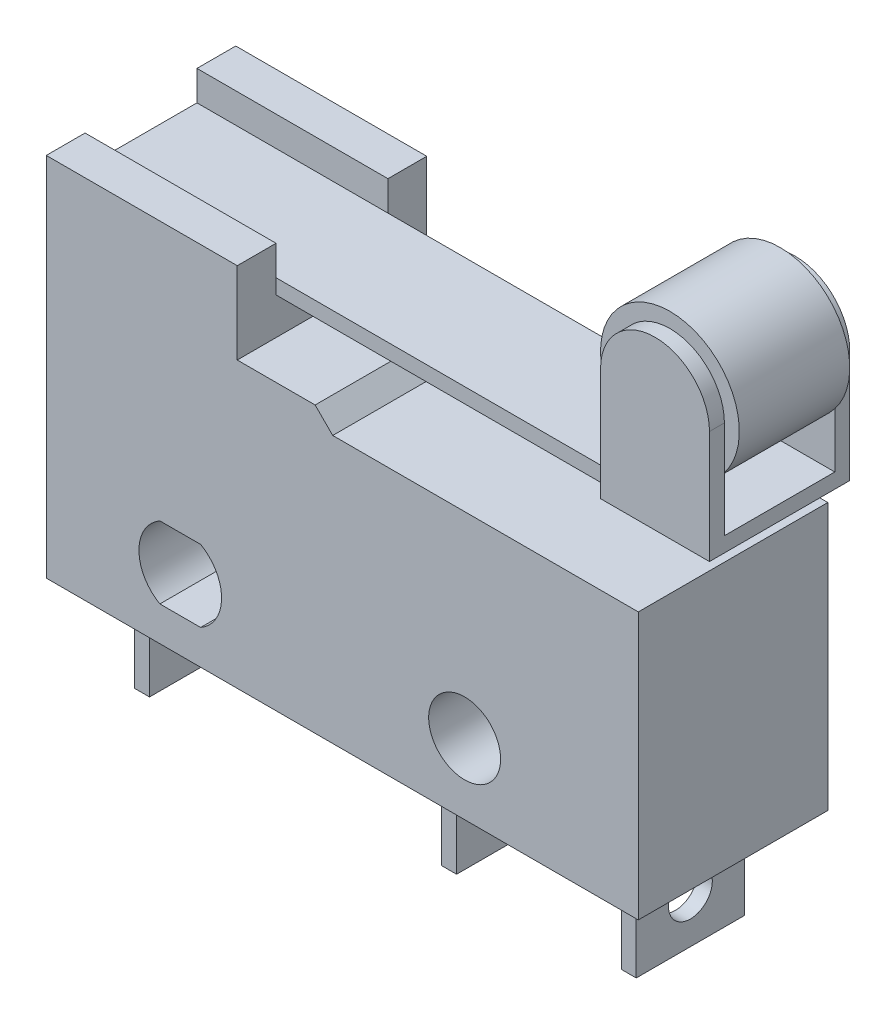
from build123d import *

# Parameters (mm, degrees)
SKETCH_1_R                  = 1.205
EXTRUDE_1_DEPTH             = 3.175
SKETCH_2_W                  = 0.5
SKETCH_2_H                  = 3.63
EXTRUDE_2_DEPTH             = 3.08
SKETCH_3_R                  = 0.735
CUT_EXTRUDE_1_DEPTH         = 21.998730652
SKETCH_4_W                  = 6.4
SKETCH_4_H                  = 3.75
CUT_EXTRUDE_2_DEPTH         = 1
SKETCH_6_W                  = 21.4
SKETCH_6_H                  = 3.75
EXTRUDE_3_DEPTH             = 0.5
SKETCH_7_W                  = 3.65
SKETCH_7_H                  = 4.7
EXTRUDE_4_DEPTH             = 0.5
EXTRUDE_5_DEPTH             = 0.5
EXTRUDE_7_REACH             = 22.071
SKETCH_9_R                  = 2.325
EXTRUDE_7_DIRECTION_2_REACH = 22.071


with BuildPart() as part:
    # 스케치1 → 보스-돌출1 (new, symmetric)
    with BuildSketch(Plane.XY):
        Polygon((-14.02, -2.36), (5.82, -2.36), (5.82, 6.58), (-4.42, 6.58), (-5.01, 7.17), (-7.62, 7.17), (-7.62, 9.908), (-14.02, 9.908), (-14.02, 6.58), align=None)
        Circle(SKETCH_1_R, mode=Mode.SUBTRACT)
        with BuildLine():
            Line((-10.212788401, 1.205), (-8.847211599, 1.205))
            ThreePointArc((-8.847211599, 1.205), (-8.145, 0), (-8.847211599, -1.205))
            Line((-8.847211599, -1.205), (-10.212788401, -1.205))
            ThreePointArc((-10.212788401, -1.205), (-10.915, 0), (-10.212788401, 1.205))
        make_face(mode=Mode.SUBTRACT)
    extrude(amount=EXTRUDE_1_DEPTH, both=True)

    # 스케치2 → 보스-돌출2 (add)
    with BuildSketch(Plane.XZ.offset(2.36)):
        with Locations((-12.17, 0)):
            Rectangle(SKETCH_2_W, SKETCH_2_H)
        with Locations((-1.88, 0)):
            Rectangle(SKETCH_2_W, SKETCH_2_H)
        with Locations((4.14, 0)):
            Rectangle(SKETCH_2_W, SKETCH_2_H)
    extrude(amount=EXTRUDE_2_DEPTH)

    # 스케치3 → 컷-돌출1 (cut, through all)
    with BuildSketch(Plane.ZY.offset(12.42)):
        with Locations(Location((0, -3.9, 0), (0, 0, 270))):
            Circle(SKETCH_3_R)
    extrude(amount=-CUT_EXTRUDE_1_DEPTH, mode=Mode.SUBTRACT)

    # 스케치4 → 컷-돌출2 (cut)
    with BuildSketch(Plane(origin=(0, 9.908, 0), x_dir=(1, 0, 0), z_dir=(0, 1, 0))):
        with Locations((-10.82, 0)):
            Rectangle(SKETCH_4_W, SKETCH_4_H)
    extrude(amount=-CUT_EXTRUDE_2_DEPTH, mode=Mode.SUBTRACT)

    # 스케치6 → 보스-돌출3 (add)
    with BuildSketch(Plane(origin=(0, 8.908, 0), x_dir=(1, 0, 0), z_dir=(0, 1, 0))):
        with Locations((-3.32, 0)):
            Rectangle(SKETCH_6_W, SKETCH_6_H)
    extrude(amount=-EXTRUDE_3_DEPTH)

    # 스케치7 → 보스-돌출4 (add)
    with BuildSketch(Plane(origin=(0, 8.908, 0), x_dir=(1, 0, 0), z_dir=(0, 1, 0))):
        with Locations((5.555, 0)):
            Rectangle(SKETCH_7_W, SKETCH_7_H)
    extrude(amount=-EXTRUDE_4_DEPTH)

    # 스케치8 → 보스-돌출5 (add)
    with BuildSketch(Plane.XY.offset(2.35)):
        with BuildLine():
            Line((3.73, 8.408), (7.38, 8.408))
            Line((7.38, 8.408), (7.38, 12.183))
            ThreePointArc((7.38, 12.183), (5.555, 14.008), (3.73, 12.183))
            Line((3.73, 12.183), (3.73, 8.408))
        make_face()
    extrude_5 = extrude(amount=-EXTRUDE_5_DEPTH)

    # 대칭 복사1: 보스-돌출5 across plane
    add(extrude_5.mirror(Plane.XY))

    # 보스-돌출7: up to this face of the body (flat: up to its plane)
    extrude_7_end = Plane(part.part.faces().sort_by_distance((5.555, 11.279795549, 1.85))[0])
    # 스케치9 → 보스-돌출7 (add, up to the picked face)
    with BuildSketch(Plane.XY, mode=Mode.PRIVATE) as extrude_7_sk1:
        with Locations(Location((5.555, 12.183, 0), (0, 0, 218.284293925))):
            Circle(SKETCH_9_R)
    extrude_7_tool1 = split(extrude(extrude_7_sk1.sketch, amount=EXTRUDE_7_REACH, mode=Mode.PRIVATE), bisect_by=extrude_7_end, keep=Keep.BOTH, mode=Mode.PRIVATE)
    add(extrude_7_tool1.solids().sort_by(Axis((5.555, 12.183, 0), (0, 0, 1)))[0])

    # 보스-돌출7 direction 2: up to this face of the body (flat: up to its plane)
    extrude_7_direction_2_end = Plane(part.part.faces().sort_by_distance((5.555, 11.279795549, -1.85))[0])
    # 스케치9 → 보스-돌출7 direction 2 (add, up to the picked face)
    with BuildSketch(Plane.XY, mode=Mode.PRIVATE) as extrude_7_direction_2_sk1:
        with Locations(Location((5.555, 12.183, 0), (0, 0, 218.284293925))):
            Circle(SKETCH_9_R)
    extrude_7_direction_2_tool1 = split(extrude(extrude_7_direction_2_sk1.sketch, amount=-EXTRUDE_7_DIRECTION_2_REACH, mode=Mode.PRIVATE), bisect_by=extrude_7_direction_2_end, keep=Keep.BOTH, mode=Mode.PRIVATE)
    add(extrude_7_direction_2_tool1.solids().sort_by(Axis((5.555, 12.183, 0), (0, 0, -1)))[0])


solid = part.part
